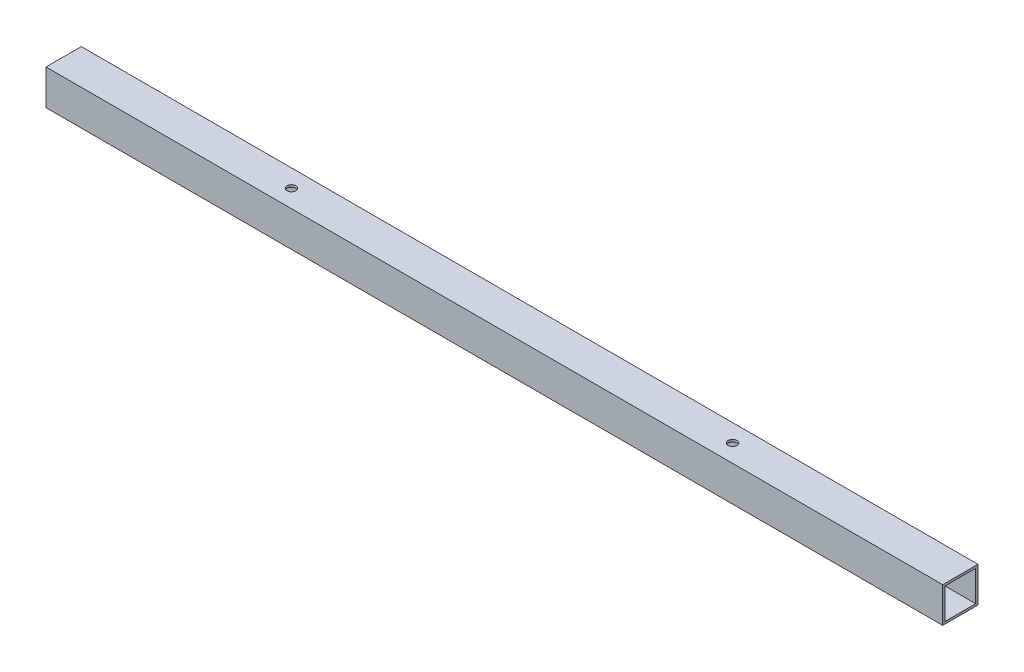
from build123d import *

# Parameters (mm, degrees)
SKETCH16_W                                     = 25.4
SKETCH16_H                                     = 25.4
SKETCH16_W_2                                   = 22.098
SKETCH16_H_2                                   = 22.098
AL_TUBE_SQUARE_AL_TUBE_1_SQR_X_0_065_WAL_DEPTH = 645.4
F_1_4_0_25_DIAMETER_HOLE1_D                    = 6.35


with BuildPart() as part:
    # Sketch16 → Al tube square AL TUBE 1 SQR X 0.065 WALL(1) (new body)
    with BuildSketch(Plane(origin=(0, 0, 0), x_dir=(0, 0, -1), z_dir=(1, 0, 0))):
        Rectangle(SKETCH16_W, SKETCH16_H)
        Rectangle(SKETCH16_W_2, SKETCH16_H_2, mode=Mode.SUBTRACT)
    extrude(amount=AL_TUBE_SQUARE_AL_TUBE_1_SQR_X_0_065_WAL_DEPTH)

    # 1/4 (0.25) Diameter Hole1 (through all)
    with Locations(Plane(origin=(0, 12.7, 0), x_dir=(1, 0, 0), z_dir=(0, 1, 0))):
        with Locations((481.45, 0), (163.95, 0)):
            Hole(F_1_4_0_25_DIAMETER_HOLE1_D / 2)


solid = part.part
